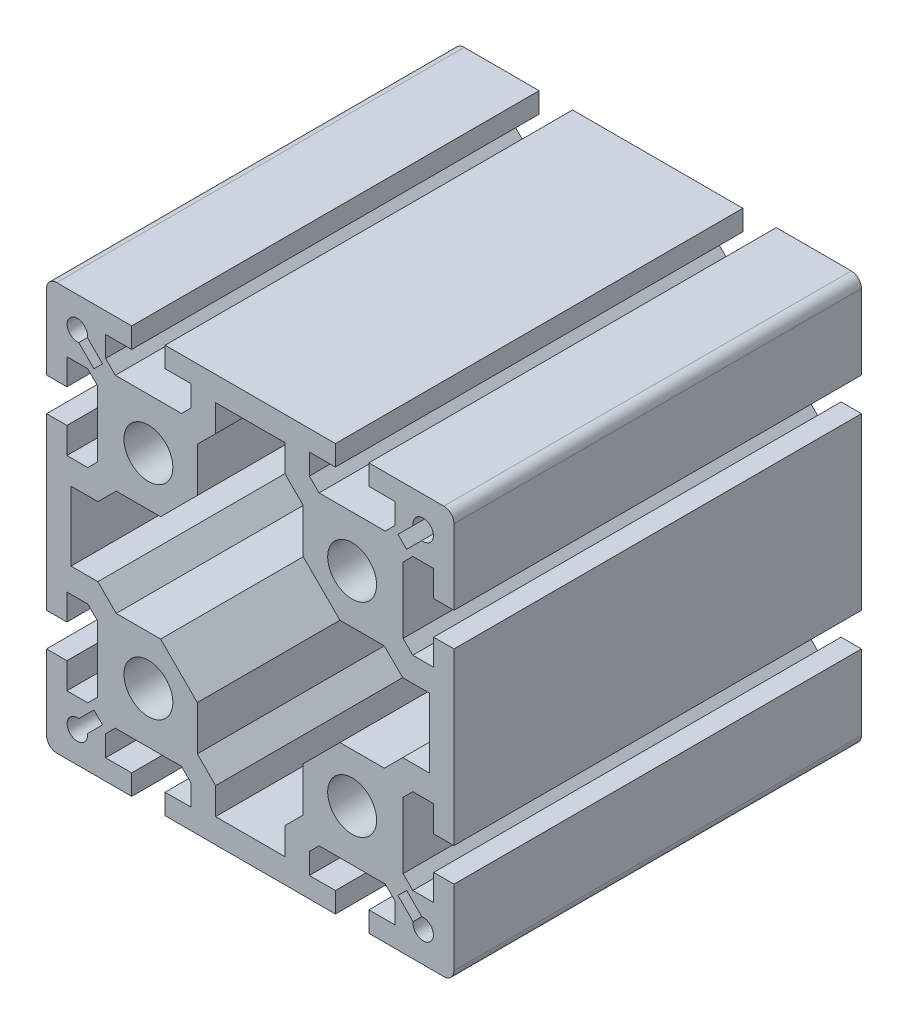
from build123d import *

# Parameters (mm, degrees)
SKETCH_1_R      = 6
EXTRUDE_1_DEPTH = 100


with BuildPart() as part:
    # 草图1 → 凸台-拉伸1 (new body)
    with BuildSketch(Plane.XY):
        with BuildLine():
            Line((-28.674392903, 51.362622721), (-47.074392903, 51.362622721))
            ThreePointArc((-47.074392903, 51.362622721), (-48.842159856, 50.630389674), (-49.574392903, 48.862622721))
            Line((-49.574392903, 48.862622721), (-49.574392903, 30.462622721))
            Line((-49.574392903, 30.462622721), (-44.574392903, 30.462622721))
            Line((-44.574392903, 30.462622721), (-44.574392903, 36.862622721))
            Line((-44.574392903, 36.862622721), (-39.458454947, 36.862622721))
            Line((-39.458454947, 36.862622721), (-37.074392903, 34.478560678))
            Line((-37.074392903, 34.478560678), (-37.074392903, 26.362622721))
            Line((-37.074392903, 26.362622721), (-37.074392903, 18.246684764))
            Line((-37.074392903, 18.246684764), (-39.458454947, 15.862622721))
            Line((-39.458454947, 15.862622721), (-44.574392903, 15.862622721))
            Line((-44.574392903, 15.862622721), (-44.574392903, 22.262622721))
            Line((-44.574392903, 22.262622721), (-49.574392903, 22.262622721))
            Line((-49.574392903, 22.262622721), (-49.574392903, 1.362622721))
            Line((-49.574392903, 1.362622721), (-49.574392903, -19.537377279))
            Line((-49.574392903, -19.537377279), (-44.574392903, -19.537377279))
            Line((-44.574392903, -19.537377279), (-44.574392903, -13.137377279))
            Line((-44.574392903, -13.137377279), (-39.458454947, -13.137377279))
            Line((-39.458454947, -13.137377279), (-37.074392903, -15.521439322))
            Line((-37.074392903, -15.521439322), (-37.074392903, -23.637377279))
            Line((-37.074392903, -23.637377279), (-37.074392903, -31.753315236))
            Line((-37.074392903, -31.753315236), (-39.458454947, -34.137377279))
            Line((-39.458454947, -34.137377279), (-44.574392903, -34.137377279))
            Line((-44.574392903, -34.137377279), (-44.574392903, -27.737377279))
            Line((-44.574392903, -27.737377279), (-49.574392903, -27.737377279))
            Line((-49.574392903, -27.737377279), (-49.574392903, -46.137377279))
            ThreePointArc((-49.574392903, -46.137377279), (-48.842159856, -47.905144232), (-47.074392903, -48.637377279))
            Line((-47.074392903, -48.637377279), (-28.674392903, -48.637377279))
            Line((-28.674392903, -48.637377279), (-28.674392903, -43.637377279))
            Line((-28.674392903, -43.637377279), (-35.074392903, -43.637377279))
            Line((-35.074392903, -43.637377279), (-35.074392903, -38.521439322))
            Line((-35.074392903, -38.521439322), (-32.69033086, -36.137377279))
            Line((-32.69033086, -36.137377279), (-24.574392903, -36.137377279))
            Line((-24.574392903, -36.137377279), (-16.458454947, -36.137377279))
            Line((-16.458454947, -36.137377279), (-14.074392903, -38.521439322))
            Line((-14.074392903, -38.521439322), (-14.074392903, -43.637377279))
            Line((-14.074392903, -43.637377279), (-20.474392903, -43.637377279))
            Line((-20.474392903, -43.637377279), (-20.474392903, -48.637377279))
            Line((-20.474392903, -48.637377279), (0.425607097, -48.637377279))
            Line((0.425607097, -48.637377279), (21.325607097, -48.637377279))
            Line((21.325607097, -48.637377279), (21.325607097, -43.637377279))
            Line((21.325607097, -43.637377279), (14.925607097, -43.637377279))
            Line((14.925607097, -43.637377279), (14.925607097, -38.521439322))
            Line((14.925607097, -38.521439322), (17.30966914, -36.137377279))
            Line((17.30966914, -36.137377279), (25.425607097, -36.137377279))
            Line((25.425607097, -36.137377279), (33.541545053, -36.137377279))
            Line((33.541545053, -36.137377279), (35.925607097, -38.521439322))
            Line((35.925607097, -38.521439322), (35.925607097, -43.637377279))
            Line((35.925607097, -43.637377279), (29.525607097, -43.637377279))
            Line((29.525607097, -43.637377279), (29.525607097, -48.637377279))
            Line((29.525607097, -48.637377279), (47.925607097, -48.637377279))
            ThreePointArc((47.925607097, -48.637377279), (49.69337405, -47.905144232), (50.425607097, -46.137377279))
            Line((50.425607097, -46.137377279), (50.425607097, -27.737377279))
            Line((50.425607097, -27.737377279), (45.425607097, -27.737377279))
            Line((45.425607097, -27.737377279), (45.425607097, -34.137377279))
            Line((45.425607097, -34.137377279), (40.30966914, -34.137377279))
            Line((40.30966914, -34.137377279), (37.925607097, -31.753315236))
            Line((37.925607097, -31.753315236), (37.925607097, -23.637377279))
            Line((37.925607097, -23.637377279), (37.925607097, -15.521439322))
            Line((37.925607097, -15.521439322), (40.30966914, -13.137377279))
            Line((40.30966914, -13.137377279), (45.425607097, -13.137377279))
            Line((45.425607097, -13.137377279), (45.425607097, -19.537377279))
            Line((45.425607097, -19.537377279), (50.425607097, -19.537377279))
            Line((50.425607097, -19.537377279), (50.425607097, 1.362622721))
            Line((50.425607097, 1.362622721), (50.425607097, 22.262622721))
            Line((50.425607097, 22.262622721), (45.425607097, 22.262622721))
            Line((45.425607097, 22.262622721), (45.425607097, 15.862622721))
            Line((45.425607097, 15.862622721), (40.30966914, 15.862622721))
            Line((40.30966914, 15.862622721), (37.925607097, 18.246684764))
            Line((37.925607097, 18.246684764), (37.925607097, 26.362622721))
            Line((37.925607097, 26.362622721), (37.925607097, 34.478560678))
            Line((37.925607097, 34.478560678), (40.30966914, 36.862622721))
            Line((40.30966914, 36.862622721), (45.425607097, 36.862622721))
            Line((45.425607097, 36.862622721), (45.425607097, 30.462622721))
            Line((45.425607097, 30.462622721), (50.425607097, 30.462622721))
            Line((50.425607097, 30.462622721), (50.425607097, 48.862622721))
            ThreePointArc((50.425607097, 48.862622721), (49.69337405, 50.630389674), (47.925607097, 51.362622721))
            Line((47.925607097, 51.362622721), (29.525607097, 51.362622721))
            Line((29.525607097, 51.362622721), (29.525607097, 46.362622721))
            Line((29.525607097, 46.362622721), (35.925607097, 46.362622721))
            Line((35.925607097, 46.362622721), (35.925607097, 41.246684764))
            Line((35.925607097, 41.246684764), (33.541545053, 38.862622721))
            Line((33.541545053, 38.862622721), (25.425607097, 38.862622721))
            Line((25.425607097, 38.862622721), (17.30966914, 38.862622721))
            Line((17.30966914, 38.862622721), (14.925607097, 41.246684764))
            Line((14.925607097, 41.246684764), (14.925607097, 46.362622721))
            Line((14.925607097, 46.362622721), (21.325607097, 46.362622721))
            Line((21.325607097, 46.362622721), (21.325607097, 51.362622721))
            Line((21.325607097, 51.362622721), (0.425607097, 51.362622721))
            Line((0.425607097, 51.362622721), (-20.474392903, 51.362622721))
            Line((-20.474392903, 51.362622721), (-20.474392903, 46.362622721))
            Line((-20.474392903, 46.362622721), (-14.074392903, 46.362622721))
            Line((-14.074392903, 46.362622721), (-14.074392903, 41.246684764))
            Line((-14.074392903, 41.246684764), (-16.458454947, 38.862622721))
            Line((-16.458454947, 38.862622721), (-24.574392903, 38.862622721))
            Line((-24.574392903, 38.862622721), (-32.69033086, 38.862622721))
            Line((-32.69033086, 38.862622721), (-35.074392903, 41.246684764))
            Line((-35.074392903, 41.246684764), (-35.074392903, 46.362622721))
            Line((-35.074392903, 46.362622721), (-28.674392903, 46.362622721))
            Line((-28.674392903, 46.362622721), (-28.674392903, 51.362622721))
        make_face()
        with Locations((-24.574392903, 26.362622721)):
            Circle(SKETCH_1_R, mode=Mode.SUBTRACT)
        with Locations((25.425607097, 26.362622721)):
            Circle(SKETCH_1_R, mode=Mode.SUBTRACT)
        with Locations((-24.574392903, -23.637377279)):
            Circle(SKETCH_1_R, mode=Mode.SUBTRACT)
        with Locations((25.425607097, -23.637377279)):
            Circle(SKETCH_1_R, mode=Mode.SUBTRACT)
        with BuildLine():
            Line((-35.826372672, 39.735922833), (-39.541550191, 43.451100352))
            ThreePointArc((-39.541550191, 43.451100352), (-43.784190878, 45.572420696), (-41.662870534, 41.329780008))
            Line((-41.662870534, 41.329780008), (-37.947693016, 37.61460249))
            Line((-37.947693016, 37.61460249), (-35.826372672, 39.735922833))
        make_face(mode=Mode.SUBTRACT)
        Polygon((-8.074392903, 45.362622721), (-8.074392903, 38.76140339), (-12.574392903, 34.26140339), (-12.574392903, 23.362622721), (-21.574392903, 14.362622721), (-32.473173572, 14.362622721), (-36.973173572, 9.862622721), (-43.574392903, 9.862622721), (-43.574392903, 1.362622721), (-43.574392903, -7.137377279), (-36.973173572, -7.137377279), (-32.473173572, -11.637377279), (-21.574392903, -11.637377279), (-12.574392903, -20.637377279), (-12.574392903, -31.536157948), (-8.074392903, -36.036157948), (-8.074392903, -42.637377279), (0.425607097, -42.637377279), (8.925607097, -42.637377279), (8.925607097, -36.036157948), (13.425607097, -31.536157948), (13.425607097, -20.637377279), (22.425607097, -11.637377279), (33.324387766, -11.637377279), (37.824387766, -7.137377279), (44.425607097, -7.137377279), (44.425607097, 1.362622721), (44.425607097, 9.862622721), (37.824387766, 9.862622721), (33.324387766, 14.362622721), (22.425607097, 14.362622721), (13.425607097, 23.362622721), (13.425607097, 34.26140339), (8.925607097, 38.76140339), (8.925607097, 45.362622721), (0.425607097, 45.362622721), align=None, mode=Mode.SUBTRACT)
        with BuildLine():
            Line((36.677586865, 39.735922833), (40.392764384, 43.451100352))
            ThreePointArc((40.392764384, 43.451100352), (44.635405071, 45.572420696), (42.514084728, 41.329780008))
            Line((42.514084728, 41.329780008), (38.798907209, 37.61460249))
            Line((38.798907209, 37.61460249), (36.677586865, 39.735922833))
        make_face(mode=Mode.SUBTRACT)
        with BuildLine():
            Line((-35.826372672, -37.010677391), (-39.541550191, -40.72585491))
            ThreePointArc((-39.541550191, -40.72585491), (-43.784190878, -42.847175254), (-41.662870534, -38.604534567))
            Line((-41.662870534, -38.604534567), (-37.947693016, -34.889357048))
            Line((-37.947693016, -34.889357048), (-35.826372672, -37.010677391))
        make_face(mode=Mode.SUBTRACT)
        with BuildLine():
            Line((36.677586865, -37.010677391), (40.392764384, -40.72585491))
            ThreePointArc((40.392764384, -40.72585491), (44.635405071, -42.847175254), (42.514084728, -38.604534567))
            Line((42.514084728, -38.604534567), (38.798907209, -34.889357048))
            Line((38.798907209, -34.889357048), (36.677586865, -37.010677391))
        make_face(mode=Mode.SUBTRACT)
    extrude(amount=EXTRUDE_1_DEPTH)


solid = part.part
